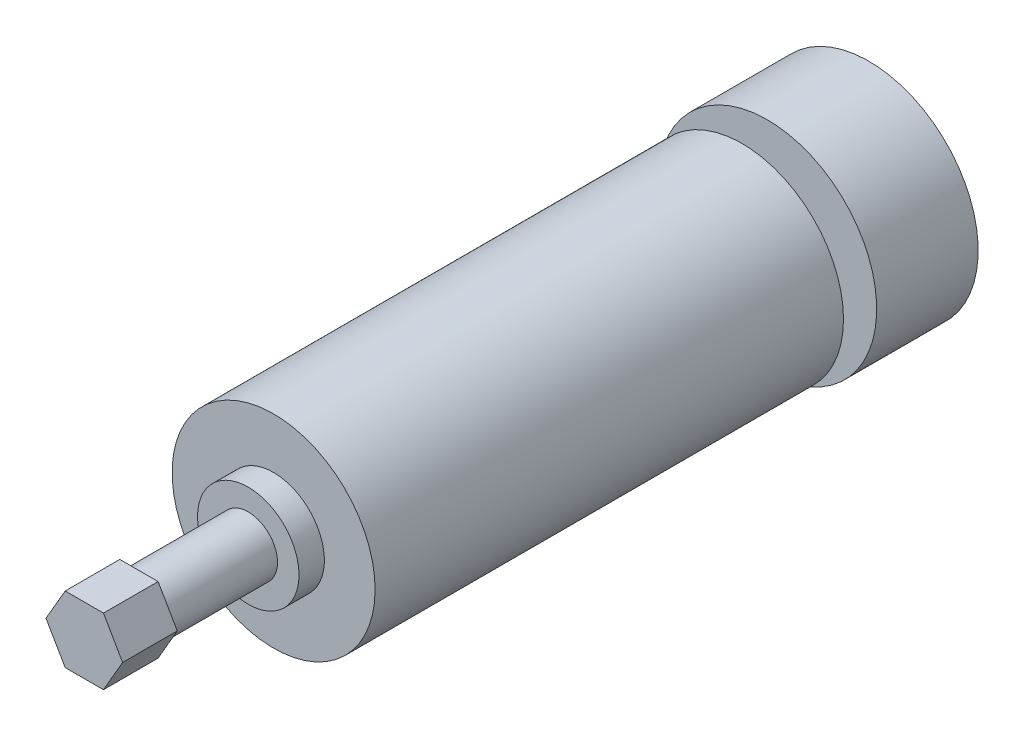
from build123d import *

# Parameters (mm, degrees)
ESQUISSE1_R        = 26
BOSS_EXTRU_1_DEPTH = 120
ESQUISSE2_R        = 13
BOSS_EXTRU_2_DEPTH = 6.5
BOSS_EXTRU_3_START = 6.5
ESQUISSE3_R        = 13
BOSS_EXTRU_3_DEPTH = 6.5
ESQUISSE4_R        = 7.5
BOSS_EXTRU_4_DEPTH = 28
BOSS_EXTRU_5_DEPTH = 14
ESQUISSE6_R        = 28
BOSS_EXTRU_6_DEPTH = 26


with BuildPart() as part:
    # Esquisse1 → Boss.-Extru.1 (new body)
    with BuildSketch(Plane.XY):
        Circle(ESQUISSE1_R)
    extrude(amount=BOSS_EXTRU_1_DEPTH)

    # Esquisse2 → Boss.-Extru.2 (add)
    with BuildSketch(Plane.XY.offset(120)):
        with Locations(Location((0, 0, 0), (0, 0, 180))):
            Circle(ESQUISSE2_R)
    extrude(amount=BOSS_EXTRU_2_DEPTH)

    # Esquisse3 → Boss.-Extru.3 (add)
    with BuildSketch(Plane(origin=(0, 0, 0), x_dir=(-1, 0, 0), z_dir=(0, 0, -1)).offset(BOSS_EXTRU_3_START)):
        Circle(ESQUISSE3_R)
    extrude(amount=-BOSS_EXTRU_3_DEPTH)

    # Esquisse4 → Boss.-Extru.4 (add)
    with BuildSketch(Plane.XY.offset(126.5)):
        Circle(ESQUISSE4_R)
    extrude(amount=BOSS_EXTRU_4_DEPTH)

    # Esquisse5 → Boss.-Extru.5 (add)
    with BuildSketch(Plane.XY.offset(154.5)):
        Polygon((9.814954576, 0), (4.907477288, 8.5), (-4.907477288, 8.5), (-9.814954576, 0), (-4.907477288, -8.5), (4.907477288, -8.5), align=None)
    extrude(amount=BOSS_EXTRU_5_DEPTH)

    # Esquisse6 → Boss.-Extru.6 (add)
    with BuildSketch(Plane(origin=(0, 0, -6.5), x_dir=(-1, 0, 0), z_dir=(0, 0, -1))):
        Circle(ESQUISSE6_R)
    extrude(amount=BOSS_EXTRU_6_DEPTH)


solid = part.part
